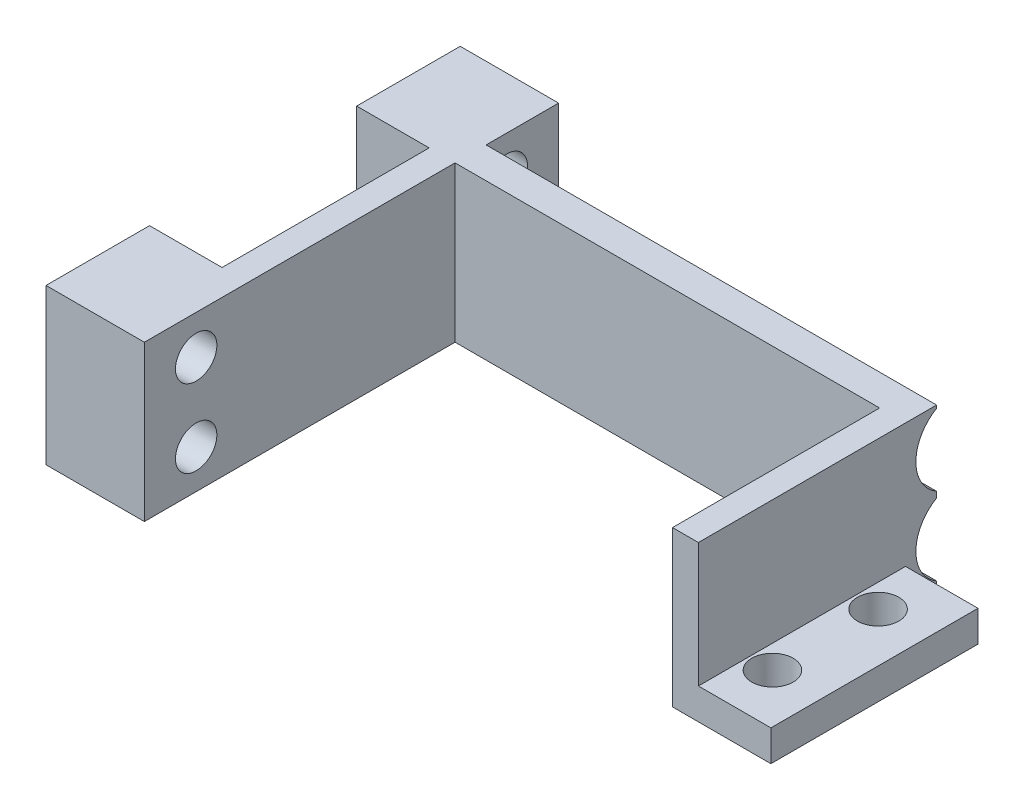
from build123d import *

# Parameters (mm, degrees)
SKETCH1_W           = 46
SKETCH1_H           = 15
BOSS_EXTRUDE1_DEPTH = 3
SKETCH3_W           = 2.5
SKETCH3_H           = 15
BOSS_EXTRUDE2_DEPTH = 20
SKETCH4_W           = 20
SKETCH4_H           = 3
BOSS_EXTRUDE3_DEPTH = 7
SKETCH5_R           = 2
CUT_EXTRUDE1_DEPTH  = 7
SKETCH7_W           = 9.5
SKETCH7_H           = 15
BOSS_EXTRUDE4_DEPTH = 10
SKETCH8_R           = 2
CUT_EXTRUDE2_DEPTH  = 10
CUT_EXTRUDE3_DEPTH  = 43.5


with BuildPart() as part:
    # Sketch1 → Boss-Extrude1 (new body)
    with BuildSketch(Plane.XY):
        with Locations((23, 7.5)):
            Rectangle(SKETCH1_W, SKETCH1_H)
    extrude(amount=BOSS_EXTRUDE1_DEPTH)

    # Sketch3 → Boss-Extrude2 (add)
    with BuildSketch(Plane.XY.offset(3)):
        with Locations((1.25, 7.5)):
            Rectangle(SKETCH3_W, SKETCH3_H)
    boss_extrude2 = extrude(amount=BOSS_EXTRUDE2_DEPTH)

    # Sketch4 → Boss-Extrude3 (add)
    with BuildSketch(Plane.ZY):
        with Locations((13, 13.5)):
            Rectangle(SKETCH4_W, SKETCH4_H)
    boss_extrude3 = extrude(amount=BOSS_EXTRUDE3_DEPTH)

    # Sketch5 → Cut-Extrude1 (cut)
    with BuildSketch(Plane(origin=(0, 15, 0), x_dir=(1, 0, 0), z_dir=(0, 1, 0))):
        with Locations(Location((-2.25, -18.1, 0), (0, 0, 270))):
            Circle(SKETCH5_R)
        with Locations(Location((-2.25, -7.9, 0), (0, 0, 270))):
            Circle(SKETCH5_R)
    cut_extrude1 = extrude(amount=-CUT_EXTRUDE1_DEPTH, mode=Mode.SUBTRACT)

    # Mirror1: Boss-Extrude2, Boss-Extrude3, Cut-Extrude1 across plane
    add(boss_extrude2.mirror(Plane(origin=(23, 0, 0), x_dir=(0, 0, 1), z_dir=(1, 0, 0))))
    add(boss_extrude3.mirror(Plane(origin=(23, 0, 0), x_dir=(0, 0, 1), z_dir=(1, 0, 0))))
    add(cut_extrude1.mirror(Plane(origin=(23, 0, 0), x_dir=(0, 0, 1), z_dir=(1, 0, 0))), mode=Mode.SUBTRACT)

    # Sketch7 → Boss-Extrude4 (add)
    with BuildSketch(Plane.XY.offset(23)):
        with Locations((-2.25, 7.5)):
            Rectangle(SKETCH7_W, SKETCH7_H)
    boss_extrude4 = extrude(amount=BOSS_EXTRUDE4_DEPTH)

    # Sketch8 → Cut-Extrude2 (cut)
    with BuildSketch(Plane.ZY.offset(7)):
        with Locations((28, 11.25)):
            Circle(SKETCH8_R)
        with Locations((28, 3.75)):
            Circle(SKETCH8_R)
    cut_extrude2 = extrude(amount=-CUT_EXTRUDE2_DEPTH, mode=Mode.SUBTRACT)

    # Mirror4: Boss-Extrude4, Cut-Extrude2 across plane
    add(boss_extrude4.mirror(Plane.XY.offset(13)))
    add(cut_extrude2.mirror(Plane.XY.offset(13)), mode=Mode.SUBTRACT)


with BuildPart() as body_2:
    # Mirror6: mirrored copy
    add(part.part.mirror(Plane.ZX.offset(-10)))

    # Sketch10 → Cut-Extrude3 (cut)
    with BuildSketch(Plane(origin=(2.5, 0, 0), x_dir=(0, 0, -1), z_dir=(1, 0, 0))):
        with BuildLine():
            ThreePointArc((3.391941091, -27.5), (2, -19.75), (0.608058909, -27.5))
            ThreePointArc((0.608058909, -27.5), (2, -35.25), (3.391941091, -27.5))
        make_face()
    extrude(amount=CUT_EXTRUDE3_DEPTH, mode=Mode.SUBTRACT)


solid = body_2.part
